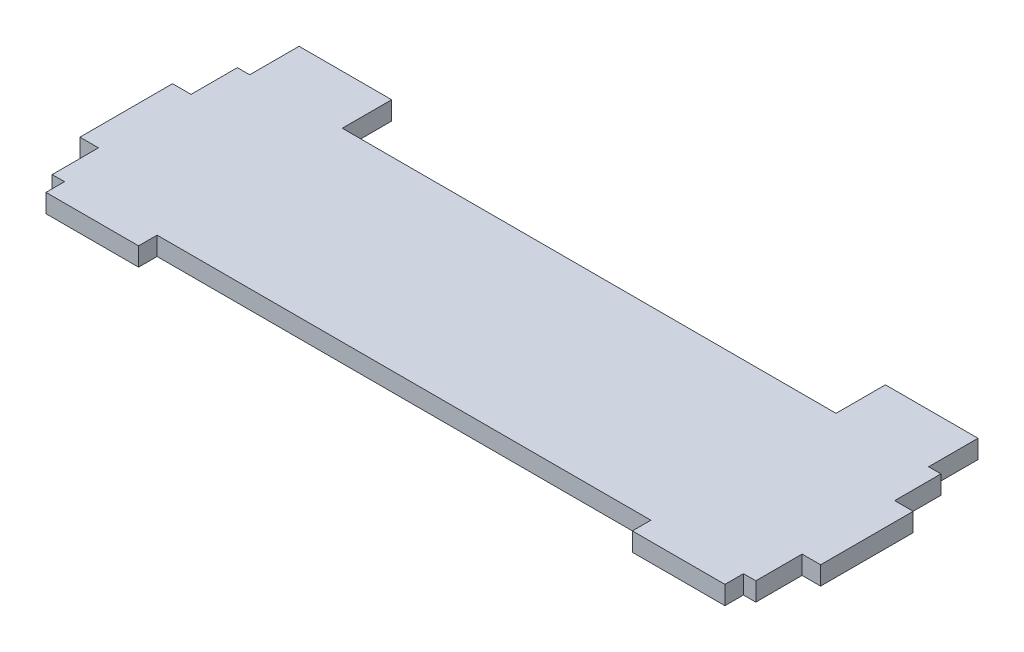
from build123d import *

# Parameters (mm, degrees)
BOSS_EXTRUDE1_DEPTH = 3


with BuildPart() as part:
    # Sketch1 → Boss-Extrude1 (new body)
    with BuildSketch(Plane(origin=(0, 0, 0), x_dir=(1, 0, 0), z_dir=(0, 1, 0))):
        Polygon((57, 15), (57, 7.5), (60, 7.5), (60, -7.5), (57, -7.5), (57, -15), (55, -15), (55, -18), (40, -18), (40, -15), (-40, -15), (-40, -18), (-55, -18), (-55, -15), (-57, -15), (-57, -7.5), (-60, -7.5), (-60, 7.5), (-57, 7.5), (-57, 15), (-55, 15), (-55, 23), (-40, 23), (-40, 15), (40, 15), (40, 23), (55, 23), (55, 15), align=None)
    extrude(amount=BOSS_EXTRUDE1_DEPTH)


solid = part.part
